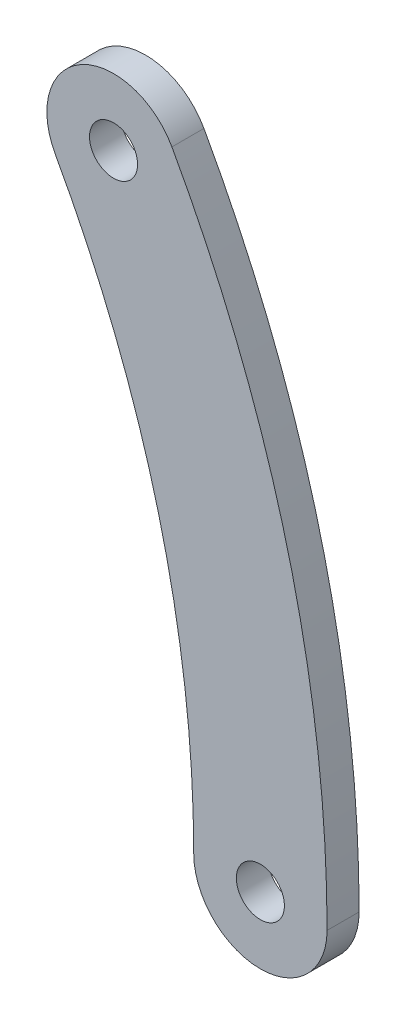
from build123d import *

# Parameters (mm, degrees)
ESTRUSIONE_ESTRUSIONE1_DEPTH = 3
SCHIZZO2_R                   = 2.25
TAGLIO_ESTRUSIONE1_DEPTH     = 131.62050005


with BuildPart() as part:
    # Schizzo1 → Estrusione-Estrusione1 (new body)
    with BuildSketch(Plane.XY):
        with BuildLine():
            ThreePointArc((116.244263144, 0), (112.553023812, 29.061065786), (101.713730251, 56.276511906))
            ThreePointArc((101.713730251, 56.276511906), (93.227009104, 58.717251262), (90.786269749, 50.230530114))
            ThreePointArc((90.786269749, 50.230530114), (100.461060229, 25.938934214), (103.755736856, 0))
            ThreePointArc((103.755736856, 0), (110, -6.244263144), (116.244263144, 0))
        make_face()
    extrude(amount=ESTRUSIONE_ESTRUSIONE1_DEPTH)

    # Schizzo2 → Taglio-Estrusione1 (cut, through all)
    with BuildSketch(Plane(origin=(0, 0, 0), x_dir=(-1, 0, 0), z_dir=(0, 0, -1))):
        with Locations((-110, 0)):
            Circle(SCHIZZO2_R)
        with Locations((-96.25, 53.25352101)):
            Circle(SCHIZZO2_R)
    extrude(amount=-TAGLIO_ESTRUSIONE1_DEPTH, mode=Mode.SUBTRACT)


solid = part.part
